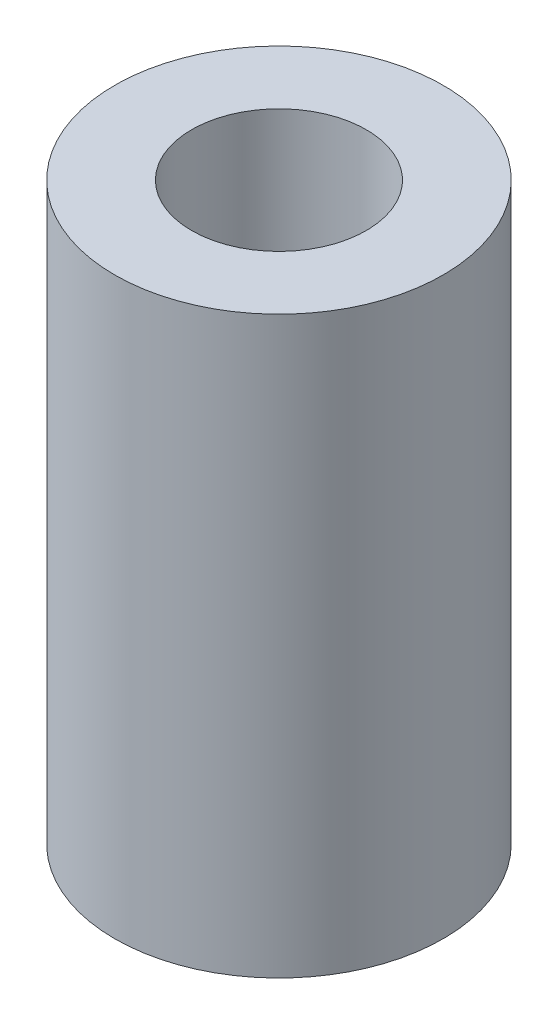
from build123d import *

# Parameters (mm, degrees)
SKETCH1_R      = 6.35
SKETCH1_R_2    = 3.3782
EXTRUDE1_DEPTH = 22.225


with BuildPart() as part:
    # Sketch1 → Extrude1 (new body)
    with BuildSketch(Plane(origin=(0, 0, 0), x_dir=(1, 0, 0), z_dir=(0, 1, 0))):
        with Locations(Location((0, 0, 0), (0, 0, 270))):
            Circle(SKETCH1_R)
        with Locations(Location((0, 0, 0), (0, 0, 270))):
            Circle(SKETCH1_R_2, mode=Mode.SUBTRACT)
    extrude(amount=EXTRUDE1_DEPTH)


solid = part.part
